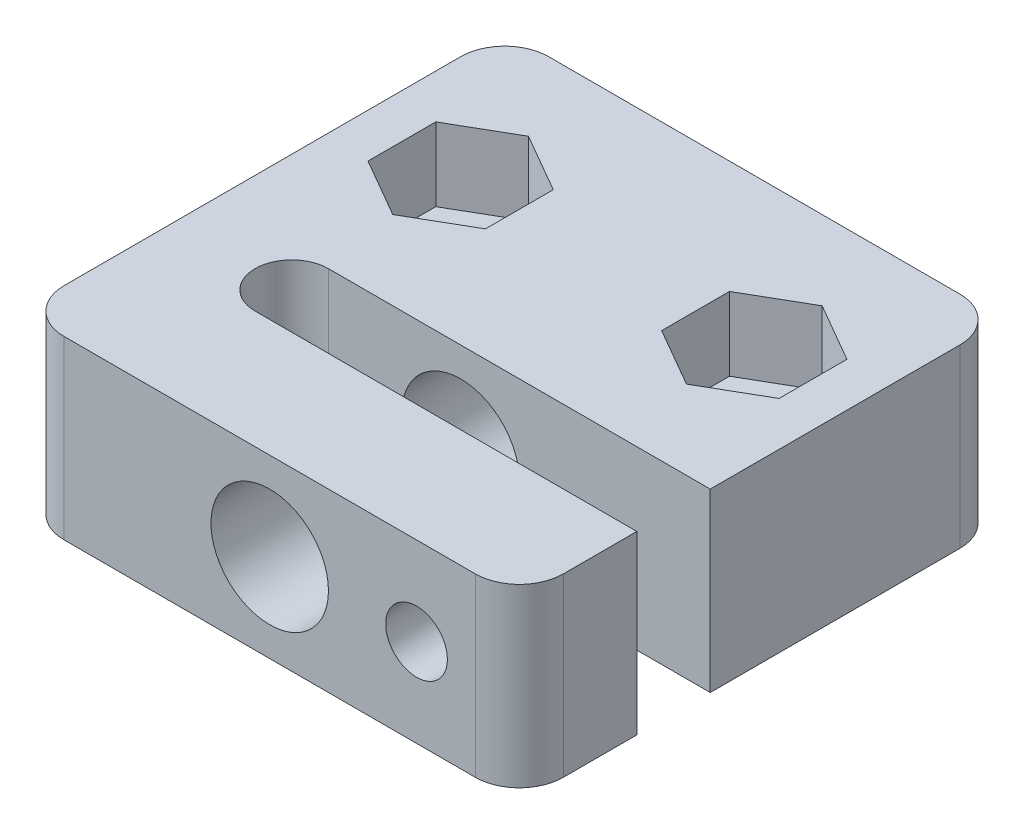
from build123d import *

# Parameters (mm, degrees)
SKETCH1_W                 = 34
SKETCH1_H                 = 12
BOSS_EXTRUDE1_DEPTH       = 16.5
SKETCH2_R                 = 4
CUT_EXTRUDE1_DEPTH        = 38.603191354
SKETCH3_R                 = 2.55
CUT_EXTRUDE2_DEPTH        = 27.55654345
CUT_EXTRUDE3_DEPTH        = 5
SKETCH5_R                 = 4.5
CUT_EXTRUDE4_DEPTH        = 2
CUT_EXTRUDE5_DEPTH        = 27.55654345
M5X0_8_TAPPED_HOLE1_D     = 4.2
M5X0_8_TAPPED_HOLE1_DEPTH = 8
FILLET1_R                 = 3


with BuildPart() as part:
    # Sketch1 → Boss-Extrude1 (new, symmetric)
    with BuildSketch(Plane.XY):
        Rectangle(SKETCH1_W, SKETCH1_H)
    extrude(amount=BOSS_EXTRUDE1_DEPTH, both=True)

    # Sketch2 → Cut-Extrude1 (cut, through all)
    with BuildSketch(Plane.XY.offset(16.5)):
        Circle(SKETCH2_R)
    extrude(amount=-CUT_EXTRUDE1_DEPTH, mode=Mode.SUBTRACT)

    # Sketch3 → Cut-Extrude2 (cut, through all)
    with BuildSketch(Plane(origin=(0, 6, 0), x_dir=(1, 0, 0), z_dir=(0, 1, 0))):
        with Locations(Location((-10, 6.5, 0), (0, 0, 180))):
            Circle(SKETCH3_R)
        with Locations((10, 6.5)):
            Circle(SKETCH3_R)
    extrude(amount=-CUT_EXTRUDE2_DEPTH, mode=Mode.SUBTRACT)

    # Sketch4 → Cut-Extrude3 (cut)
    with BuildSketch(Plane(origin=(0, 6, 0), x_dir=(1, 0, 0), z_dir=(0, 1, 0))):
        Polygon((-10, 11.118802154), (-14, 8.809401077), (-14, 4.190598923), (-10, 1.881197846), (-6, 4.190598923), (-6, 8.809401077), align=None)
        Polygon((6, 8.809401077), (10, 11.118802154), (14, 8.809401077), (14, 4.190598923), (10, 1.881197846), (6, 4.190598923), align=None)
    extrude(amount=-CUT_EXTRUDE3_DEPTH, mode=Mode.SUBTRACT)

    # Sketch5 → Cut-Extrude4 (cut)
    with BuildSketch(Plane.XZ.offset(6)):
        with Locations((10, -6.5)):
            Circle(SKETCH5_R)
        with Locations((-10, -6.5)):
            Circle(SKETCH5_R)
    extrude(amount=-CUT_EXTRUDE4_DEPTH, mode=Mode.SUBTRACT)

    # Sketch6 → Cut-Extrude5 (cut, through all)
    with BuildSketch(Plane(origin=(0, 6, 0), x_dir=(1, 0, 0), z_dir=(0, 1, 0))):
        with BuildLine():
            Line((17, -8.5), (-9, -8.5))
            ThreePointArc((-9, -8.5), (-11.5, -6), (-9, -3.5))
            Line((-9, -3.5), (17, -3.5))
            ThreePointArc((17, -3.5), (19.5, -6), (17, -8.5))
        make_face()
    extrude(amount=-CUT_EXTRUDE5_DEPTH, mode=Mode.SUBTRACT)

    # M5x0.8 Tapped Hole1
    with Locations(Plane.XY.offset(16.5)):
        with Locations((10, 0)):
            Hole(M5X0_8_TAPPED_HOLE1_D / 2, depth=M5X0_8_TAPPED_HOLE1_DEPTH)

    # Fillet1
    fillet1_edges = [part.edges().sort_by_distance(p)[0] for p in [
        (17, 0, 16.5),
        (-17, 0, 16.5),
        (17, 0, -16.5),
        (-17, 0, -16.5),
    ]]
    fillet(fillet1_edges, radius=FILLET1_R)


solid = part.part
